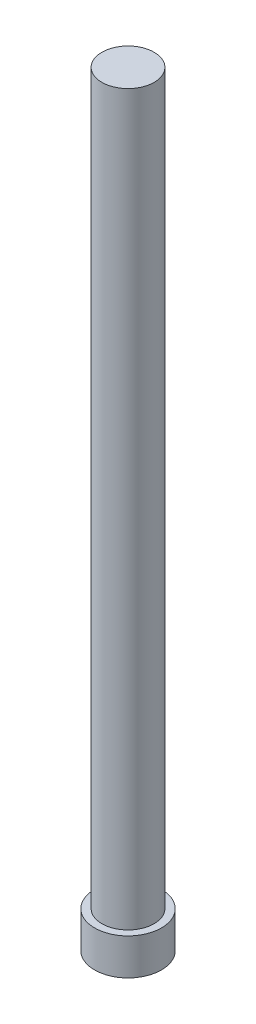
from build123d import *

# Parameters (mm, degrees)
SKETCH1_R           = 2.15
BOSS_EXTRUDE1_DEPTH = 60
SKETCH2_R           = 2.75
BOSS_EXTRUDE2_DEPTH = 3


with BuildPart() as part:
    # Sketch1 → Boss-Extrude1 (new body)
    with BuildSketch(Plane(origin=(0, 0, 0), x_dir=(1, 0, 0), z_dir=(0, 1, 0))):
        Circle(SKETCH1_R)
    extrude(amount=BOSS_EXTRUDE1_DEPTH)

    # Sketch2 → Boss-Extrude2 (add)
    with BuildSketch(Plane.XZ):
        Circle(SKETCH2_R)
    extrude(amount=BOSS_EXTRUDE2_DEPTH)


solid = part.part
